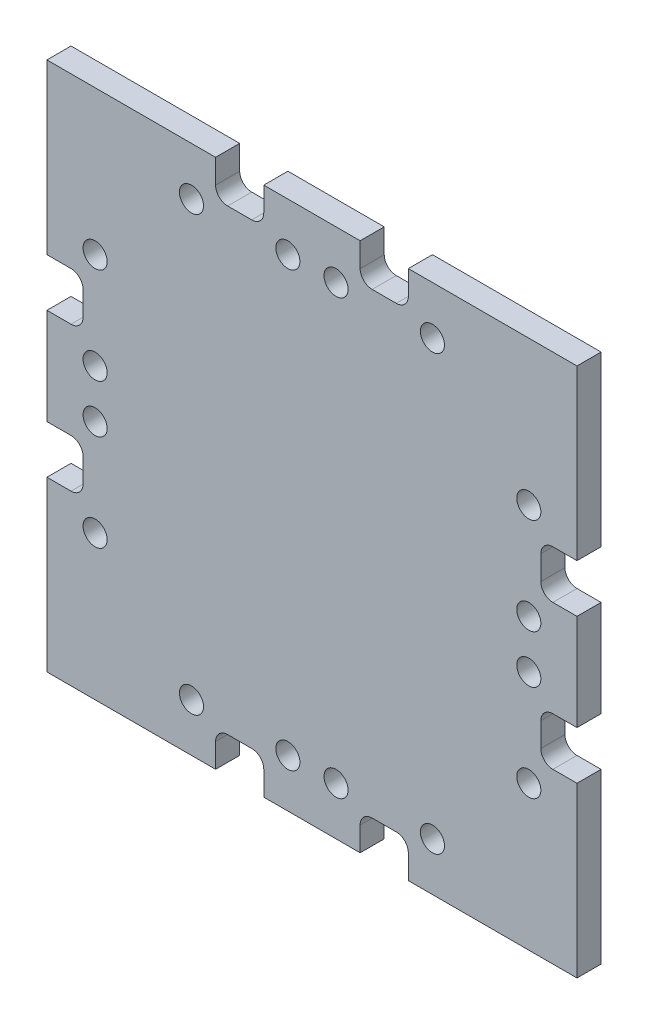
from build123d import *

# Parameters (mm, degrees)
SKETCH_1_R          = 1
EXTRUDE_4_DEPTH     = 2
FILLET_1_R          = 1
EXTRUDE_5_DEPTH     = 2
SKETCH_5_R          = 1
CUT_EXTRUDE_3_DEPTH = 2
SKETCH_6_W          = 8
SKETCH_6_H          = 3
EXTRUDE_6_DEPTH     = 2


with BuildPart() as part:
    # 草圖1 → 填料-伸長4 (new body)
    with BuildSketch(Plane.XY):
        with BuildLine():
            Line((-19.246232324, 5.793640832), (-17.246232324, 5.793640832))
            ThreePointArc((-17.246232324, 5.793640832), (-16.539125543, 5.500747613), (-16.246232324, 4.793640832))
            Line((-16.246232324, 4.793640832), (-16.246232324, 2.793640832))
            ThreePointArc((-16.246232324, 2.793640832), (-16.539125543, 2.086534051), (-17.246232324, 1.793640832))
            Line((-17.246232324, 1.793640832), (-19.246232324, 1.793640832))
            Line((-19.246232324, 1.793640832), (-19.246232324, -6.206359168))
            Line((-19.246232324, -6.206359168), (-17.246232324, -6.206359168))
            ThreePointArc((-17.246232324, -6.206359168), (-16.539125543, -6.499252387), (-16.246232324, -7.206359168))
            Line((-16.246232324, -7.206359168), (-16.246232324, -9.206359168))
            ThreePointArc((-16.246232324, -9.206359168), (-16.539125543, -9.913465949), (-17.246232324, -10.206359168))
            Line((-17.246232324, -10.206359168), (-19.246232324, -10.206359168))
            Line((-19.246232324, -10.206359168), (-19.246232324, -18.206359168))
            Line((-19.246232324, -18.206359168), (24.753767676, -18.206359168))
            Line((24.753767676, -18.206359168), (24.753767676, -10.206359168))
            Line((24.753767676, -10.206359168), (22.753767676, -10.206359168))
            ThreePointArc((22.753767676, -10.206359168), (22.046660894, -9.913465949), (21.753767676, -9.206359168))
            Line((21.753767676, -9.206359168), (21.753767676, -7.206359168))
            ThreePointArc((21.753767676, -7.206359168), (22.046660894, -6.499252387), (22.753767676, -6.206359168))
            Line((22.753767676, -6.206359168), (24.753767676, -6.206359168))
            Line((24.753767676, -6.206359168), (24.753767676, 1.793640832))
            Line((24.753767676, 1.793640832), (22.753767676, 1.793640832))
            ThreePointArc((22.753767676, 1.793640832), (22.046660894, 2.086534051), (21.753767676, 2.793640832))
            Line((21.753767676, 2.793640832), (21.753767676, 4.793640832))
            ThreePointArc((21.753767676, 4.793640832), (22.046660894, 5.500747613), (22.753767676, 5.793640832))
            Line((22.753767676, 5.793640832), (24.753767676, 5.793640832))
            Line((24.753767676, 5.793640832), (24.753767676, 13.793640832))
            Line((24.753767676, 13.793640832), (-19.246232324, 13.793640832))
            Line((-19.246232324, 13.793640832), (-19.246232324, 5.793640832))
        make_face()
        with Locations((-15.246232324, 7.793640832)):
            Circle(SKETCH_1_R, mode=Mode.SUBTRACT)
        with Locations((-15.246232324, -0.206359168)):
            Circle(SKETCH_1_R, mode=Mode.SUBTRACT)
        with Locations((20.753767676, -12.206359168)):
            Circle(SKETCH_1_R, mode=Mode.SUBTRACT)
        with Locations((20.753767676, 7.793640832)):
            Circle(SKETCH_1_R, mode=Mode.SUBTRACT)
        with Locations((-15.246232324, -4.206359168)):
            Circle(SKETCH_1_R, mode=Mode.SUBTRACT)
        with Locations((-15.246232324, -12.206359168)):
            Circle(SKETCH_1_R, mode=Mode.SUBTRACT)
        with Locations((20.753767676, -0.206359168)):
            Circle(SKETCH_1_R, mode=Mode.SUBTRACT)
        with Locations((20.753767676, -4.206359168)):
            Circle(SKETCH_1_R, mode=Mode.SUBTRACT)
    extrude(amount=EXTRUDE_4_DEPTH)

    # 圓角1
    fillet_1_edges = [part.edges().sort_by_distance(p)[0] for p in [
        (-19.246232324, 13.793640832, 1),
        (24.753767676, 13.793640832, 1),
        (24.753767676, -18.206359168, 1),
        (-19.246232324, -18.206359168, 1),
    ]]
    fillet(fillet_1_edges, radius=FILLET_1_R)

    # 草圖4 → 填料-伸長5 (add)
    with BuildSketch(Plane.XY.offset(2)):
        with BuildLine():
            Line((-19.246232324, -21.206359168), (-19.246232324, -17.206359168))
            Line((-19.246232324, -17.206359168), (24.753767676, -17.206359168))
            Line((24.753767676, -17.206359168), (24.753767676, -21.206359168))
            ThreePointArc((24.753767676, -21.206359168), (24.460874457, -21.913465949), (23.753767676, -22.206359168))
            Line((23.753767676, -22.206359168), (-18.246232324, -22.206359168))
            ThreePointArc((-18.246232324, -22.206359168), (-18.953339106, -21.913465949), (-19.246232324, -21.206359168))
        make_face()
        with BuildLine():
            Line((-19.246232324, 12.793640832), (24.753767676, 12.793640832))
            Line((24.753767676, 12.793640832), (24.753767676, 16.793640832))
            ThreePointArc((24.753767676, 16.793640832), (24.460874457, 17.500747613), (23.753767676, 17.793640832))
            Line((23.753767676, 17.793640832), (-18.246232324, 17.793640832))
            ThreePointArc((-18.246232324, 17.793640832), (-18.953339106, 17.500747613), (-19.246232324, 16.793640832))
            Line((-19.246232324, 16.793640832), (-19.246232324, 12.793640832))
        make_face()
    extrude(amount=-EXTRUDE_5_DEPTH)

    # 草圖5 → 除料-伸長3 (cut)
    with BuildSketch(Plane.XY.offset(2)):
        with Locations(Location((12.753767676, 15.793640832, 0), (0, 0, 180))):
            Circle(SKETCH_5_R)
        with Locations(Location((0.753767676, 15.793640832, 0), (0, 0, 180))):
            Circle(SKETCH_5_R)
        with Locations(Location((0.753767676, -20.206359168, 0), (0, 0, 180))):
            Circle(SKETCH_5_R)
        with Locations(Location((-7.246232324, -20.206359168, 0), (0, 0, 180))):
            Circle(SKETCH_5_R)
        with Locations(Location((4.753767676, -20.206359168, 0), (0, 0, 180))):
            Circle(SKETCH_5_R)
        with Locations(Location((12.753767676, -20.206359168, 0), (0, 0, 180))):
            Circle(SKETCH_5_R)
        with Locations(Location((-7.246232324, 15.793640832, 0), (0, 0, 180))):
            Circle(SKETCH_5_R)
        with Locations(Location((4.753767676, 15.793640832, 0), (0, 0, 180))):
            Circle(SKETCH_5_R)
        with BuildLine():
            Line((-5.246232324, 19.793640832), (-1.246232324, 19.793640832))
            Line((-1.246232324, 19.793640832), (-1.246232324, 17.793640832))
            ThreePointArc((-1.246232324, 17.793640832), (-1.539125543, 17.086534051), (-2.246232324, 16.793640832))
            Line((-2.246232324, 16.793640832), (-4.246232324, 16.793640832))
            ThreePointArc((-4.246232324, 16.793640832), (-4.953339106, 17.086534051), (-5.246232324, 17.793640832))
            Line((-5.246232324, 17.793640832), (-5.246232324, 19.793640832))
        make_face()
        with BuildLine():
            Line((9.753767676, 16.793640832), (7.753767676, 16.793640832))
            ThreePointArc((7.753767676, 16.793640832), (7.046660894, 17.086534051), (6.753767676, 17.793640832))
            Line((6.753767676, 17.793640832), (6.753767676, 19.793640832))
            Line((6.753767676, 19.793640832), (10.753767676, 19.793640832))
            Line((10.753767676, 19.793640832), (10.753767676, 17.793640832))
            ThreePointArc((10.753767676, 17.793640832), (10.460874457, 17.086534051), (9.753767676, 16.793640832))
        make_face()
        with BuildLine():
            Line((10.753767676, -24.206359168), (6.753767676, -24.206359168))
            Line((6.753767676, -24.206359168), (6.753767676, -22.206359168))
            ThreePointArc((6.753767676, -22.206359168), (7.046660894, -21.499252387), (7.753767676, -21.206359168))
            Line((7.753767676, -21.206359168), (9.753767676, -21.206359168))
            ThreePointArc((9.753767676, -21.206359168), (10.460874457, -21.499252387), (10.753767676, -22.206359168))
            Line((10.753767676, -22.206359168), (10.753767676, -24.206359168))
        make_face()
        with BuildLine():
            Line((-4.246232324, -21.206359168), (-2.246232324, -21.206359168))
            ThreePointArc((-2.246232324, -21.206359168), (-1.539125543, -21.499252387), (-1.246232324, -22.206359168))
            Line((-1.246232324, -22.206359168), (-1.246232324, -24.206359168))
            Line((-1.246232324, -24.206359168), (-5.246232324, -24.206359168))
            Line((-5.246232324, -24.206359168), (-5.246232324, -22.206359168))
            ThreePointArc((-5.246232324, -22.206359168), (-4.953339106, -21.499252387), (-4.246232324, -21.206359168))
        make_face()
    extrude(amount=-CUT_EXTRUDE_3_DEPTH, mode=Mode.SUBTRACT)

    # 草圖6 → 填料-伸長6 (add)
    with BuildSketch(Plane.XY.offset(2)):
        Polygon((-19.246232324, -23.206359168), (-19.246232324, -21.206359168), (-5.246232324, -21.206359168), (-5.246232324, -24.206359168), (-18.246232324, -24.206359168), (-19.246232324, -24.206359168), align=None)
        Polygon((-19.246232324, 16.793640832), (-5.246232324, 16.793640832), (-5.246232324, 17.793640832), (-5.246232324, 19.793640832), (-18.246232324, 19.793640832), (-19.246232324, 19.793640832), (-19.246232324, 18.793640832), align=None)
        Polygon((24.753767676, 16.793640832), (24.753767676, 18.793640832), (24.753767676, 19.793640832), (23.753767676, 19.793640832), (10.753767676, 19.793640832), (10.753767676, 16.793640832), align=None)
        Polygon((24.753767676, -21.206359168), (24.753767676, -23.206359168), (24.753767676, -24.206359168), (23.753767676, -24.206359168), (10.753767676, -24.206359168), (10.753767676, -21.206359168), align=None)
        Polygon((-1.246232324, 17.793640832), (-1.246232324, 16.793640832), (6.753767676, 16.793640832), (6.753767676, 19.793640832), (-1.246232324, 19.793640832), align=None)
        with Locations((2.753767676, -22.706359168)):
            Rectangle(SKETCH_6_W, SKETCH_6_H)
    extrude(amount=-EXTRUDE_6_DEPTH)


solid = part.part
